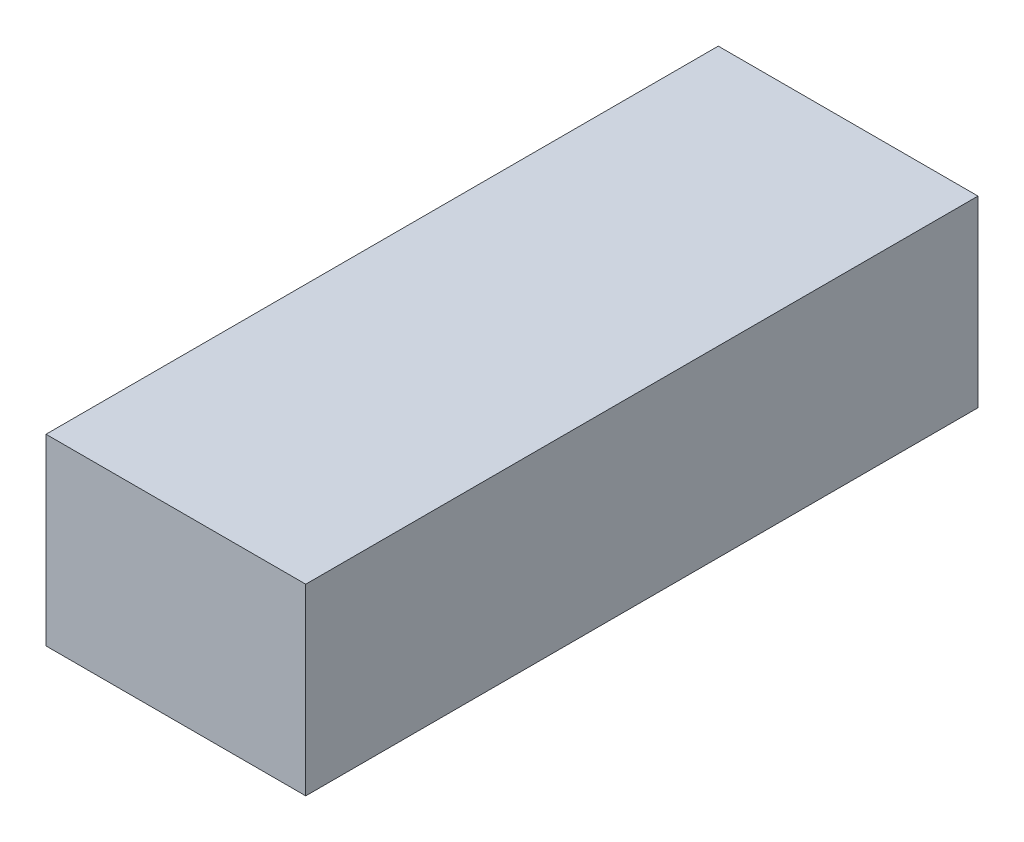
from build123d import *

# Parameters (mm, degrees)
SKETCH1_W           = 17
SKETCH1_H           = 44
BOSS_EXTRUDE1_DEPTH = 12


with BuildPart() as part:
    # Sketch1 → Boss-Extrude1 (new body)
    with BuildSketch(Plane(origin=(0, 0, 0), x_dir=(1, 0, 0), z_dir=(0, 1, 0))):
        with Locations((8.5, 22)):
            Rectangle(SKETCH1_W, SKETCH1_H)
    extrude(amount=BOSS_EXTRUDE1_DEPTH)


solid = part.part
